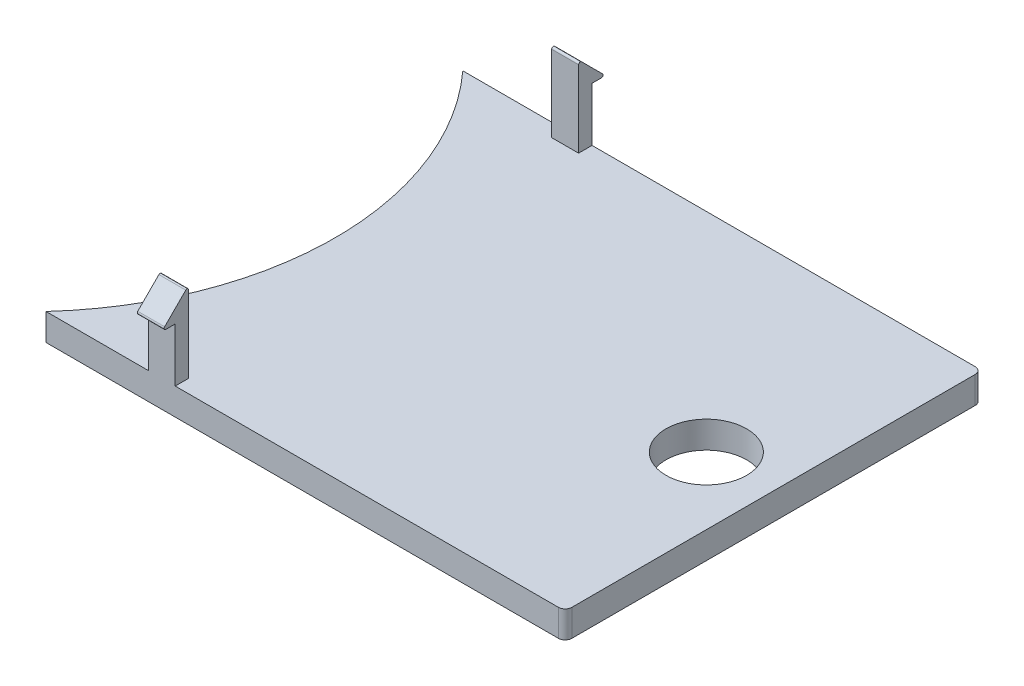
from build123d import *

# Parameters (mm, degrees)
EXTRUDE_1_DEPTH        = 4
EXTRUDE_1010_DEPTH     = 2
FILLET_1_R             = 0.25
FILLET_1_OF_MIRROR_1_R = 0.25
SKETCH_4_R             = 6
CUT_EXTRUDE_2_DEPTH    = 53.927628586


with BuildPart() as part:
    # 草图1 → 凸台-拉伸1 (new body)
    with BuildSketch(Plane(origin=(0, 0, 0), x_dir=(1, 0, 0), z_dir=(0, 1, 0))):
        with BuildLine():
            ThreePointArc((38.61, 30), (38.317106781, 30.707106781), (37.61, 31))
            Line((37.61, 31), (-38.61, 31))
            ThreePointArc((-38.61, 31), (-26.595290936, 0), (-38.61, -31))
            Line((-38.61, -31), (37.61, -31))
            ThreePointArc((37.61, -31), (38.317106781, -30.707106781), (38.61, -30))
            Line((38.61, -30), (38.61, 30))
        make_face()
    extrude(amount=EXTRUDE_1_DEPTH)

    # 草图3 → Extrude 1010 (add, symmetric)
    with BuildSketch(Plane(origin=(-21.39, 0, 0), x_dir=(0, 0, -1), z_dir=(1, 0, 0))):
        Polygon((-31, 4), (-31, 12), (-33, 12), (-29, 16), (-29, 4), align=None)
    extrude_1010 = extrude(amount=EXTRUDE_1010_DEPTH, both=True)

    # 圆角1
    fillet_1_edges = [part.edges().sort_by_distance(p)[0] for p in [
        (-21.39, 16, 29),
        (-21.39, 12, 33),
    ]]
    fillet(fillet_1_edges, radius=FILLET_1_R)

    # 镜向1: Extrude 1010 across plane
    add(extrude_1010.mirror(Plane.XY))

    # 圆角1 of 镜向1
    fillet_1_of_mirror_1_edges = [part.edges().sort_by_distance(p)[0] for p in [
        (-21.39, 16, -29),
        (-21.39, 12, -33),
    ]]
    fillet(fillet_1_of_mirror_1_edges, radius=FILLET_1_OF_MIRROR_1_R)

    # 草图4 → 切除-拉伸2 (cut, through all)
    with BuildSketch(Plane.XZ):
        with Locations((28.61, 0)):
            Circle(SKETCH_4_R)
    extrude(amount=-CUT_EXTRUDE_2_DEPTH, mode=Mode.SUBTRACT)


solid = part.part
